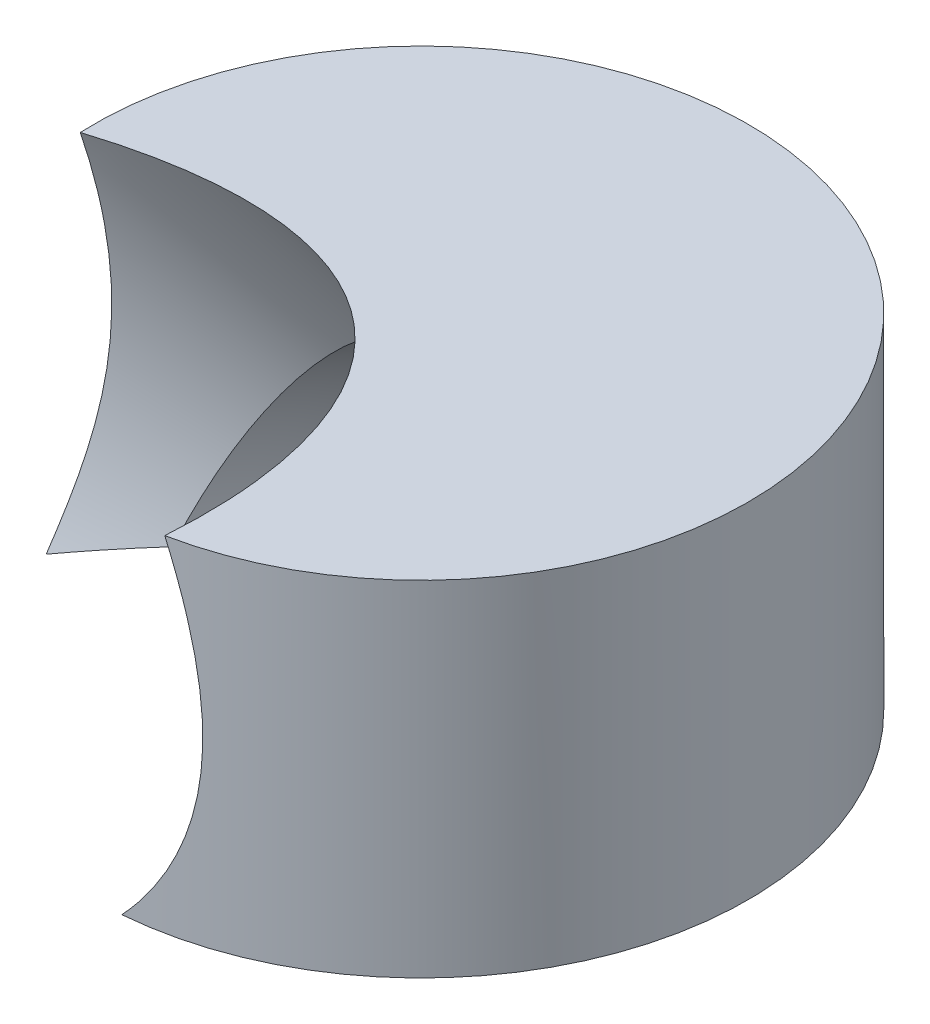
from build123d import *

# Parameters (mm, degrees)
KEYED_BACK_DEPTH   = 0.7
CUP_BLANK_SKETCH_R = 3.8
CUP_BLANK_DEPTH    = 3.3


with BuildPart() as part:
    # Keyed Back Sketch → Keyed Back (new body)
    with BuildSketch(Plane(origin=(0, -97, 0), x_dir=(-1, 0, 0), z_dir=(0, -1, 0))):
        with BuildLine():
            Line((29.790988145, 11.23573341), (33.83079012, 13.568114168))
            ThreePointArc((33.83079012, 13.568114168), (28.410889132, 18.290896534), (29.790988145, 11.23573341))
        make_face()
    extrude(amount=KEYED_BACK_DEPTH)

    # Cup Blank Sketch → Cup Blank (add)
    with BuildSketch(Plane(origin=(0, -97.7, 0), x_dir=(-1, 0, 0), z_dir=(0, -1, 0))):
        with Locations(Location((30.310889132, 15, 0), (0, 0, 262.136353638))):
            Circle(CUP_BLANK_SKETCH_R)
    extrude(amount=CUP_BLANK_DEPTH)

    # Spherical Bearing Seat profile → Spherical Bearing Seat (revolve, cut)
    with BuildSketch(Plane(origin=(0, -101, 0), x_dir=(-1, 0, 0), z_dir=(0, -1, 0))):
        with BuildLine():
            Line((30.310889132, 11.9), (30.310889132, 18.1))
            ThreePointArc((30.310889132, 18.1), (27.210889132, 15), (30.310889132, 11.9))
        make_face()
    revolve(axis=Axis((-30.310889132, -101, -25), (0, 0, 1)), mode=Mode.SUBTRACT)

    # Articulation Throat Sketch → Articulation Throat (revolve, cut)
    with BuildSketch(Plane(origin=(-55.559435073, -21.315405316, -26.260716517), x_dir=(0.37694407644157146, 0.1446147852349051, -0.9148768917876727), z_dir=(0.8541721659092646, 0.32770358269776195, 0.4037329227012915))):
        Polygon((-12.308450042, -83.441173866), (-10.724100051, -81.773890115), (-22.767880189, -61.059022025), (-28.981287547, -67.597673951), align=None)
    revolve(axis=Axis((-25.110986143, -106.383086561, -21.631997284), (-0.5199902989343897, 0.5383086561091633, 0.6631997284167648)), mode=Mode.SUBTRACT)


solid = part.part
